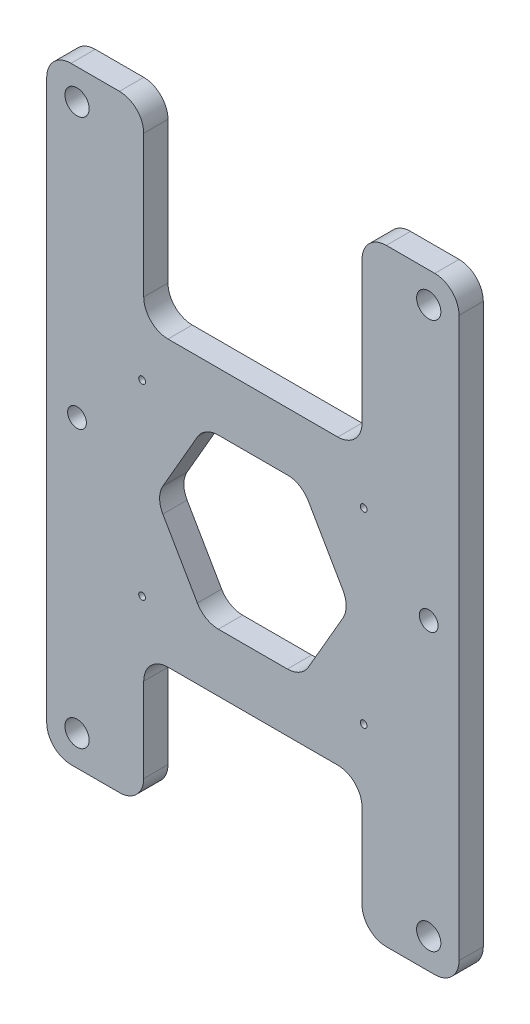
from build123d import *

# Parameters (mm, degrees)
SKETCH1_R           = 0.889
SKETCH1_R_2         = 3.175
SKETCH1_R_3         = 2.45745
BOSS_EXTRUDE1_DEPTH = 6.35
FILLET3_R           = 6.35


with BuildPart() as part:
    # Sketch1 → Boss-Extrude1 (new body)
    with BuildSketch(Plane.XY):
        Polygon((-53.975, -79.509375), (-53.975, 79.509375), (-28.575, 79.509375), (-28.575, 29.7), (28.575, 29.7), (28.575, 79.509375), (53.975, 79.509375), (53.975, -79.509375), (28.575, -79.509375), (28.575, -44.7), (-28.575, -44.7), (-28.575, -79.509375), align=None)
        with Locations((29, 17)):
            Circle(SKETCH1_R, mode=Mode.SUBTRACT)
        with Locations((29, -32)):
            Circle(SKETCH1_R, mode=Mode.SUBTRACT)
        with Locations((-29, -32)):
            Circle(SKETCH1_R, mode=Mode.SUBTRACT)
        with Locations((-29, 17)):
            Circle(SKETCH1_R, mode=Mode.SUBTRACT)
        with Locations((-46.0375, 71.571875)):
            Circle(SKETCH1_R_2, mode=Mode.SUBTRACT)
        with Locations(Location((46.0375, 71.571875, 0), (0, 0, 180))):
            Circle(SKETCH1_R_2, mode=Mode.SUBTRACT)
        with Locations(Location((-46.0375, -71.571875, 0), (0, 0, 180))):
            Circle(SKETCH1_R_2, mode=Mode.SUBTRACT)
        with Locations((46.0375, -71.571875)):
            Circle(SKETCH1_R_2, mode=Mode.SUBTRACT)
        with Locations((-46.0375, 0)):
            Circle(SKETCH1_R_3, mode=Mode.SUBTRACT)
        with Locations((46.0375, 0)):
            Circle(SKETCH1_R_3, mode=Mode.SUBTRACT)
        Polygon((-12.7, -29.497045256), (12.7, -29.497045256), (25.4, -7.5), (12.7, 14.497045256), (-12.7, 14.497045256), (-25.4, -7.5), align=None, mode=Mode.SUBTRACT)
    extrude(amount=BOSS_EXTRUDE1_DEPTH)

    # Fillet3
    fillet3_edges = [part.edges().sort_by_distance(p)[0] for p in [
        (-53.975, -79.509375, 3.175),
        (-53.975, 79.509375, 3.175),
        (-28.575, 79.509375, 3.175),
        (-28.575, 29.7, 3.175),
        (28.575, 29.7, 3.175),
        (28.575, 79.509375, 3.175),
        (53.975, 79.509375, 3.175),
        (53.975, -79.509375, 3.175),
        (28.575, -79.509375, 3.175),
        (28.575, -44.7, 3.175),
        (-28.575, -44.7, 3.175),
        (-28.575, -79.509375, 3.175),
        (-25.4, -7.5, 3.175),
        (-12.7, -29.497045256, 3.175),
        (12.7, -29.497045256, 3.175),
        (25.4, -7.5, 3.175),
        (12.7, 14.497045256, 3.175),
        (-12.7, 14.497045256, 3.175),
    ]]
    fillet(fillet3_edges, radius=FILLET3_R)


solid = part.part
